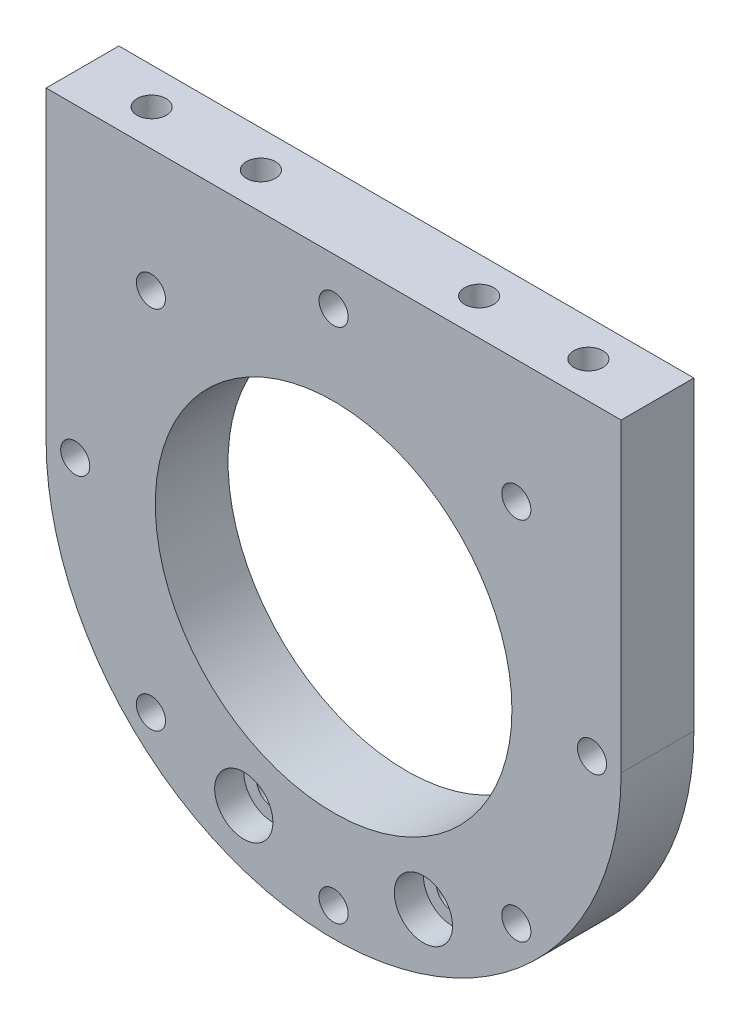
from build123d import *

# Parameters (mm, degrees)
SKETCH_1_R          = 2
SKETCH_1_R_2        = 24.5
SKETCH_1_R_3        = 2.25
EXTRUDE_1_DEPTH     = 10
SKETCH_2_R          = 2
CUT_EXTRUDE_1_DEPTH = 15
SKETCH_4_R          = 4
CUT_EXTRUDE_3_DEPTH = 4


with BuildPart() as part:
    # 스케치1 → 보스-돌출1 (new body)
    with BuildSketch(Plane.XY):
        with BuildLine():
            Line((-39.5, 0), (-39.5, 42))
            Line((-39.5, 42), (39.5, 42))
            Line((39.5, 42), (39.5, 0))
            ThreePointArc((39.5, 0), (0, -39.5), (-39.5, 0))
        make_face()
        with Locations((0, -35.5)):
            Circle(SKETCH_1_R, mode=Mode.SUBTRACT)
        with Locations((-25.102290732, -25.102290732)):
            Circle(SKETCH_1_R, mode=Mode.SUBTRACT)
        with Locations((-35.5, 0)):
            Circle(SKETCH_1_R, mode=Mode.SUBTRACT)
        with Locations((-25.102290732, 25.102290732)):
            Circle(SKETCH_1_R, mode=Mode.SUBTRACT)
        with Locations((0, 35.5)):
            Circle(SKETCH_1_R, mode=Mode.SUBTRACT)
        with Locations((25.102290732, 25.102290732)):
            Circle(SKETCH_1_R, mode=Mode.SUBTRACT)
        with Locations((35.5, 0)):
            Circle(SKETCH_1_R, mode=Mode.SUBTRACT)
        with Locations((25.102290732, -25.102290732)):
            Circle(SKETCH_1_R, mode=Mode.SUBTRACT)
        Circle(SKETCH_1_R_2, mode=Mode.SUBTRACT)
        with Locations((-12.341540694, -29.795114923)):
            Circle(SKETCH_1_R_3, mode=Mode.SUBTRACT)
        with Locations((12.341540694, -29.795114923)):
            Circle(SKETCH_1_R_3, mode=Mode.SUBTRACT)
    extrude(amount=EXTRUDE_1_DEPTH)

    # 스케치2 → 컷-돌출1 (cut)
    with BuildSketch(Plane(origin=(0, 42, 0), x_dir=(1, 0, 0), z_dir=(0, 1, 0))):
        with Locations(Location((-30, -5, 0), (0, 0, 270))):
            Circle(SKETCH_2_R)
        with Locations(Location((-15, -5, 0), (0, 0, 270))):
            Circle(SKETCH_2_R)
        with Locations(Location((15, -5, 0), (0, 0, 270))):
            Circle(SKETCH_2_R)
        with Locations(Location((30, -5, 0), (0, 0, 270))):
            Circle(SKETCH_2_R)
    extrude(amount=-CUT_EXTRUDE_1_DEPTH, mode=Mode.SUBTRACT)

    # 스케치4 → 컷-돌출3 (cut)
    with BuildSketch(Plane.XY.offset(10)):
        with Locations((-12.341540694, -29.795114923)):
            Circle(SKETCH_4_R)
        with Locations((12.341540694, -29.795114923)):
            Circle(SKETCH_4_R)
    extrude(amount=-CUT_EXTRUDE_3_DEPTH, mode=Mode.SUBTRACT)


solid = part.part
